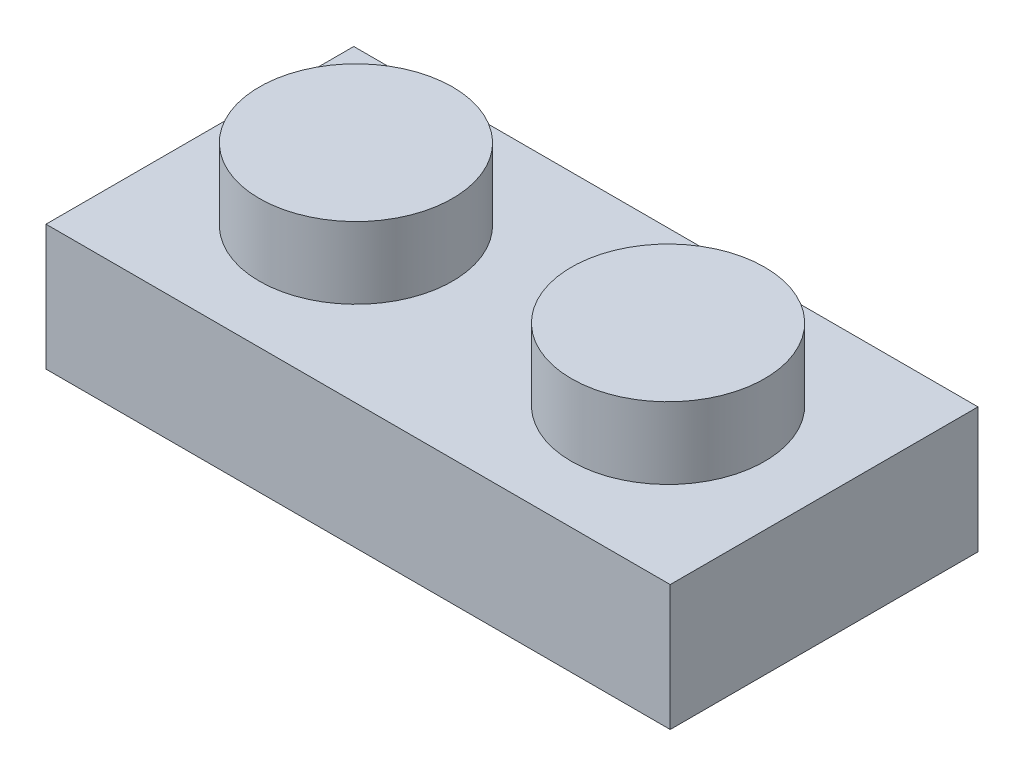
from build123d import *

# Parameters (mm, degrees)
SKETCH1_W           = 15.86
SKETCH1_H           = 7.82
BOSS_EXTRUDE1_DEPTH = 3.19
SKETCH2_R           = 2.455
BOSS_EXTRUDE2_DEPTH = 1.82
SHELL1_T            = -1.55
SKETCH3_R           = 1.485
SKETCH3_R_2         = 0.68
BOSS_EXTRUDE3_DEPTH = 1.44


with BuildPart() as part:
    # Sketch1 → Boss-Extrude1 (new body)
    with BuildSketch(Plane(origin=(0, 0, 0), x_dir=(1, 0, 0), z_dir=(0, 1, 0))):
        Rectangle(SKETCH1_W, SKETCH1_H)
    extrude(amount=-BOSS_EXTRUDE1_DEPTH)

    # Sketch2 → Boss-Extrude2 (add)
    with BuildSketch(Plane(origin=(0, 0, 0), x_dir=(1, 0, 0), z_dir=(0, 1, 0))):
        with Locations(Location((3.965, 0, 0), (0, 0, 270))):
            Circle(SKETCH2_R)
        with Locations(Location((-3.965, 0, 0), (0, 0, 270))):
            Circle(SKETCH2_R)
    extrude(amount=BOSS_EXTRUDE2_DEPTH)

    # Shell1
    shell1_openings = [part.faces().sort_by_distance(p)[0] for p in [
        (0, -3.19, 0),
    ]]
    offset(amount=SHELL1_T, openings=shell1_openings, kind=Kind.INTERSECTION)

    # Sketch3 → Boss-Extrude3 (add)
    with BuildSketch(Plane.XZ.offset(1.55)):
        with Locations(Location((0, 0, 0), (0, 0, 90))):
            Circle(SKETCH3_R)
        with Locations(Location((0, 0, 0), (0, 0, 90))):
            Circle(SKETCH3_R_2, mode=Mode.SUBTRACT)
    extrude(amount=BOSS_EXTRUDE3_DEPTH)


solid = part.part
